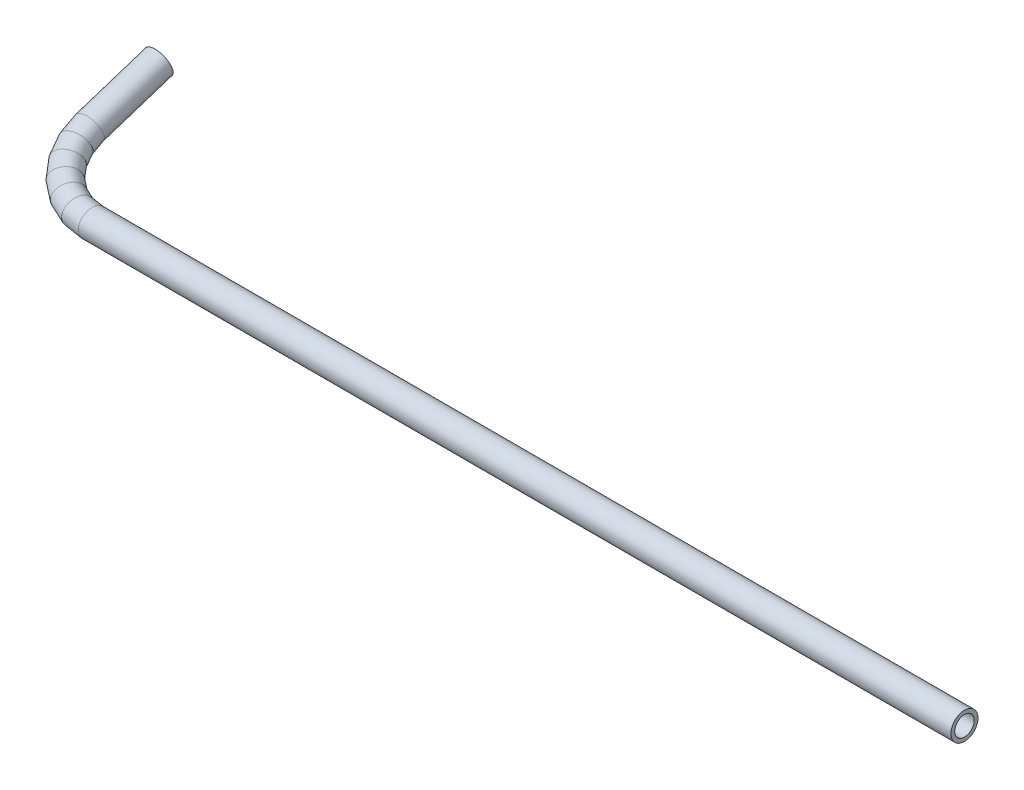
from build123d import *

# Parameters (mm, degrees)
PROFILE_R   = 3.175
PROFILE_R_2 = 2.286


with BuildPart() as part:
    # Tube: sweep along a curve in space
    with BuildLine() as tube_path:
        Line((-1894.687960479, 10.197560814, -31.384865038), (-2099.187960479, 10.197560814, -31.384865038))
        Line((-2099.187960479, 10.197560814, -31.384865038), (-2103.070246155, 10.355503296, -31.870962012))
        Line((-2103.070246155, 10.355503296, -31.870962012), (-2106.687960479, 10.81856722, -33.296126229))
        Line((-2106.687960479, 10.81856722, -33.296126229), (-2109.794562197, 11.555195547, -35.563235103))
        Line((-2109.794562197, 11.555195547, -35.563235103), (-2112.178341536, 12.515188272, -38.51778891))
        Line((-2112.178341536, 12.515188272, -38.51778891), (-2113.676847873, 13.633123479, -41.958439691))
        Line((-2113.676847873, 13.633123479, -41.958439691), (-2114.187960479, 14.83281573, -45.650712782))
        Line((-2114.187960479, 14.83281573, -45.650712782), (-2114.187960479, 20.132457184, -61.961332037))
    # Profile → Tube (sweep)
    with BuildSketch(Plane(origin=(-1894.687960479, 0, 0), x_dir=(0, 0, -1), z_dir=(1, 0, 0))):
        with Locations((31.384865038, 10.197560814)):
            Circle(PROFILE_R)
        with Locations((31.384865038, 10.197560814)):
            Circle(PROFILE_R_2, mode=Mode.SUBTRACT)
    sweep(path=tube_path.line, transition=Transition.RIGHT)


solid = part.part
